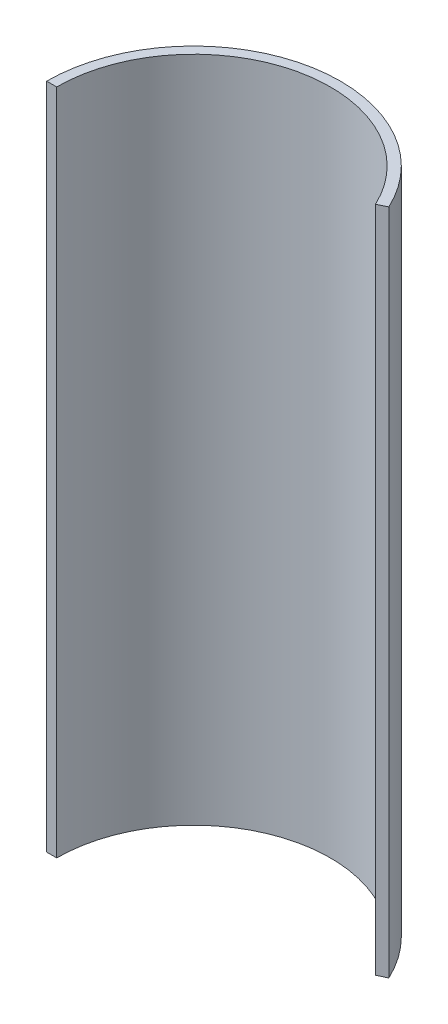
from build123d import *

# Parameters (mm, degrees)
EXTRUDE_1_DEPTH     = 50
EXTRUDE_2_DEPTH     = 7.5
CUT_EXTRUDE_1_DEPTH = 105.899189701


with BuildPart() as part:
    # 草图1 → 凸台-拉伸1 (new, symmetric)
    with BuildSketch(Plane(origin=(0, 0, 0), x_dir=(1, 0, 0), z_dir=(0, 1, 0))):
        with BuildLine():
            Line((-22, 0), (-20.5, 0))
            ThreePointArc((-20.5, 0), (0, 20.5), (20.5, 0))
            Line((20.5, 0), (22, 0))
            ThreePointArc((22, 0), (15.836666316, 15.270887335), (0.8, 21.985449734))
            ThreePointArc((0.8, 21.985449734), (-15.270887335, 15.836666316), (-22, 0))
        make_face()
    extrude(amount=EXTRUDE_1_DEPTH, both=True)

    # 草图2 → 凸台-拉伸2 (add, symmetric)
    with BuildSketch(Plane(origin=(0, 0, 0), x_dir=(1, 0, 0), z_dir=(0, 1, 0))):
        with BuildLine():
            Line((-0.8, 22.8), (-0.8, 21.985449734))
            ThreePointArc((-0.8, 21.985449734), (0, 22), (0.8, 21.985449734))
            Line((0.8, 21.985449734), (0.8, 22.8))
            Line((0.8, 22.8), (-0.8, 22.8))
        make_face()
    extrude(amount=EXTRUDE_2_DEPTH, both=True)

    # 草图3 → 切除-拉伸1 (cut, through all)
    with BuildSketch(Plane(origin=(0, 50, 0), x_dir=(1, 0, 0), z_dir=(0, 1, 0))):
        Polygon((0, 0), (22, 10.258768479), (22, 0), align=None)
    extrude(amount=-CUT_EXTRUDE_1_DEPTH, mode=Mode.SUBTRACT)


solid = part.part
